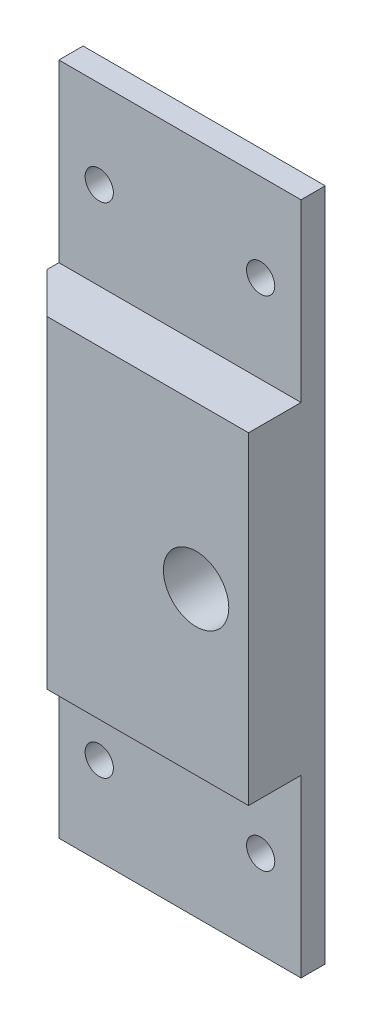
from build123d import *

# Parameters (mm, degrees)
SKETCH1_W           = 30
SKETCH1_H           = 83.5
BOSS_EXTRUDE1_DEPTH = 3
SKETCH2_W           = 30
SKETCH2_H           = 40
BOSS_EXTRUDE2_DEPTH = 6.5
SKETCH3_R           = 1.75
CUT_EXTRUDE1_DEPTH  = 7
SKETCH4_R           = 4.05
CUT_EXTRUDE2_DEPTH  = 24
CHAMFER1_SIZE       = 5


with BuildPart() as part:
    # Sketch1 → Boss-Extrude1 (new body)
    with BuildSketch(Plane.XY):
        with Locations((15, 41.75)):
            Rectangle(SKETCH1_W, SKETCH1_H)
    extrude(amount=BOSS_EXTRUDE1_DEPTH)

    # Sketch2 → Boss-Extrude2 (add)
    with BuildSketch(Plane.XY.offset(3)):
        with Locations((15, 41.75)):
            Rectangle(SKETCH2_W, SKETCH2_H)
    extrude(amount=BOSS_EXTRUDE2_DEPTH)

    # Sketch3 → Cut-Extrude1 (cut)
    with BuildSketch(Plane.XY.offset(3)):
        with Locations((5, 10.875)):
            Circle(SKETCH3_R)
        with Locations((25, 10.875)):
            Circle(SKETCH3_R)
    cut_extrude1 = extrude(amount=-CUT_EXTRUDE1_DEPTH, mode=Mode.SUBTRACT)

    # Mirror1: Cut-Extrude1 across plane
    add(cut_extrude1.mirror(Plane(origin=(0, 41.75, 0), x_dir=(0, 0, 1), z_dir=(0, -1, 0))), mode=Mode.SUBTRACT)

    # Sketch4 → Cut-Extrude2 (cut)
    with BuildSketch(Plane.XY.offset(9.5)):
        with Locations((23.5, 41.75)):
            Circle(SKETCH4_R)
    extrude(amount=-CUT_EXTRUDE2_DEPTH, mode=Mode.SUBTRACT)

    # Chamfer1
    chamfer1_edges = [part.edges().sort_by_distance(p)[0] for p in [
        (0, 41.75, 9.5),
    ]]
    chamfer(chamfer1_edges, length=CHAMFER1_SIZE)


solid = part.part
